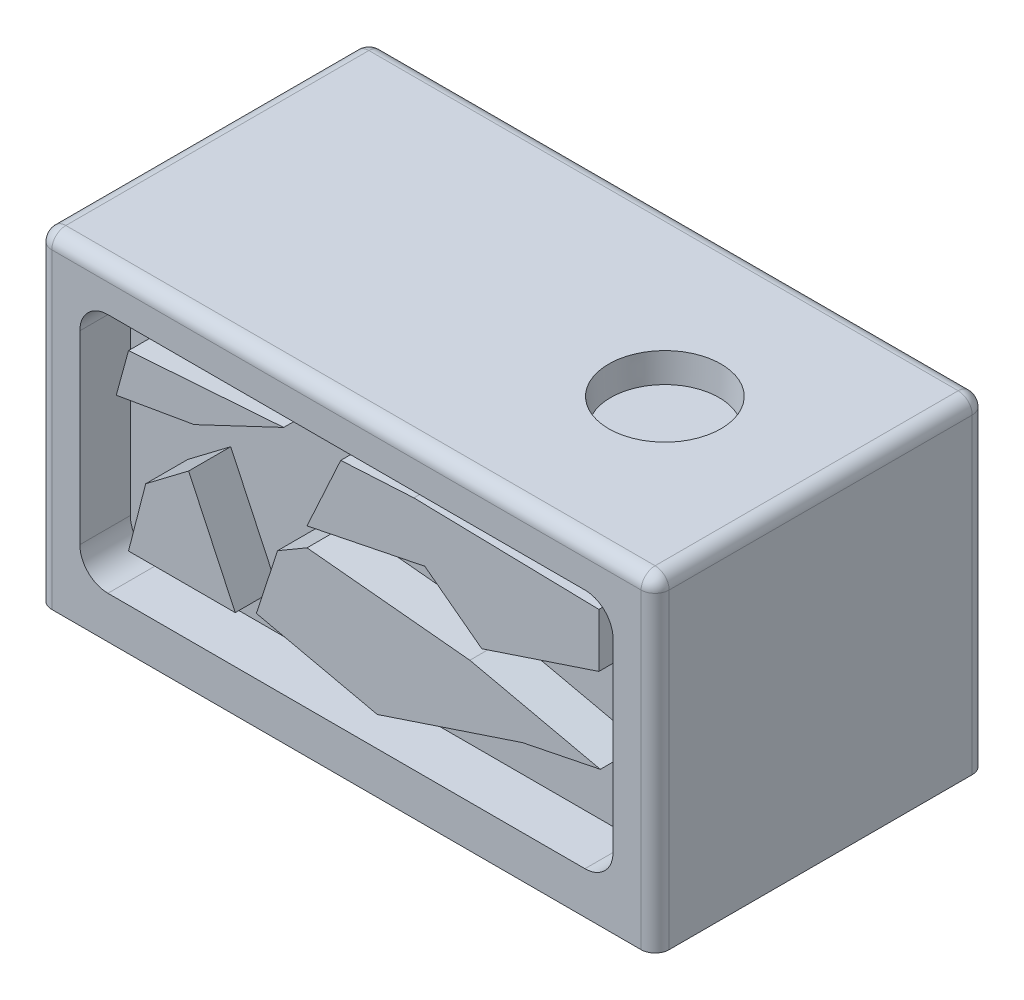
from build123d import *

# Parameters (mm, degrees)
SKETCH1_W           = 220
SKETCH1_H           = 100
SKETCH1_W_2         = 184
SKETCH1_H_2         = 64
BOSS_EXTRUDE1_DEPTH = 80
SKETCH11_W          = 220
SKETCH11_H          = 100
BOSS_EXTRUDE6_DEPTH = 18
SKETCH12_W          = 220
SKETCH12_H          = 100
BOSS_EXTRUDE7_DEPTH = 18
SKETCH2_W           = 220
SKETCH2_H           = 116
SKETCH2_W_2         = 190
SKETCH2_H_2         = 86
BOSS_EXTRUDE2_DEPTH = 18
BOSS_EXTRUDE3_DEPTH = 15
FILLET9_R           = 5
FILLET8_R           = 10
SKETCH13_R          = 5
BOSS_EXTRUDE8_DEPTH = 10
SKETCH14_W          = 16
SKETCH14_H          = 27
CUT_EXTRUDE1_DEPTH  = 10
CUT_EXTRUDE1_DRAFT  = -6
SKETCH15_R          = 20
CUT_EXTRUDE2_DEPTH  = 10
CUT_EXTRUDE2_DRAFT  = -4
SKETCH17_W          = 30
SKETCH17_H          = 40
CUT_EXTRUDE3_DEPTH  = 10


with BuildPart() as part:
    # Sketch1 → Boss-Extrude1 (new body)
    with BuildSketch(Plane(origin=(0, 0, 0), x_dir=(1, 0, 0), z_dir=(0, 1, 0))):
        with Locations((19.985024942, -17.460570406)):
            Rectangle(SKETCH1_W, SKETCH1_H)
        with Locations((19.985024942, -17.460570406)):
            Rectangle(SKETCH1_W_2, SKETCH1_H_2, mode=Mode.SUBTRACT)
    extrude(amount=BOSS_EXTRUDE1_DEPTH)

    # Sketch11 → Boss-Extrude6 (add)
    with BuildSketch(Plane(origin=(0, 80, 0), x_dir=(1, 0, 0), z_dir=(0, 1, 0))):
        with Locations((19.985024942, -17.460570406)):
            Rectangle(SKETCH11_W, SKETCH11_H)
    extrude(amount=BOSS_EXTRUDE6_DEPTH)

    # Sketch12 → Boss-Extrude7 (add)
    with BuildSketch(Plane.XZ):
        with Locations((19.985024942, 17.460570406)):
            Rectangle(SKETCH12_W, SKETCH12_H)
    extrude(amount=BOSS_EXTRUDE7_DEPTH)

    # Sketch2 → Boss-Extrude2 (add)
    with BuildSketch(Plane.XY.offset(67.460570406)):
        with Locations((19.985024942, 40)):
            Rectangle(SKETCH2_W, SKETCH2_H)
        with Locations((19.985024942, 40)):
            Rectangle(SKETCH2_W_2, SKETCH2_H_2, mode=Mode.SUBTRACT)
    extrude(amount=BOSS_EXTRUDE2_DEPTH)

    # Sketch3 → Boss-Extrude3 (add)
    with BuildSketch(Plane.XY.offset(67.460570406)):
        Polygon((14.957915815, 76.501183659), (2.936567903, 50.272788216), (44.902000614, 58.797016735), (65.229007083, 43.497119393), (98.451641312, 54.534902475), (106.944672327, 57.35660028), (106.944672327, 76.501183659), (41.011301547, 77.951227522), align=None)
        Polygon((-60.667291048, 72.566924343), (-65.038690289, 56.611317114), (-37.280305111, 61.419856279), (-5.369090654, 76.501183659), align=None)
        Polygon((-54.547332111, 34.535750949), (-39.247434769, 46.119958937), (-22.636117654, 10.711625088), (-60.667291048, 10.711625088), align=None)
        Polygon((-7.554790274, 37.377160456), (-15.111155502, 14.241854245), (27.984608681, 4.591666151), (79.685296007, 21.768539242), (107.463223985, 27.410930863), (60.959158385, 37.824320409), (2.936567903, 43.497119393), align=None)
    extrude(amount=BOSS_EXTRUDE3_DEPTH)

    # Fillet9
    fillet9_edges = [part.edges().sort_by_distance(p)[0] for p in [
        (-90.014975058, 98, 26.460570406),
        (129.985024942, 98, 26.460570406),
        (19.985024942, 98, -32.539429594),
        (19.985024942, 98, 85.460570406),
        (-90.014975058, 40, 85.460570406),
        (129.985024942, 40, 85.460570406),
        (-90.014975058, 40, -32.539429594),
        (129.985024942, 40, -32.539429594),
    ]]
    fillet(fillet9_edges, radius=FILLET9_R)

    # Fillet8
    fillet8_edges = [part.edges().sort_by_distance(p)[0] for p in [
        (-75.014975058, 83, 76.460570406),
        (114.985024942, 83, 76.460570406),
        (114.985024942, -3, 76.460570406),
        (-75.014975058, -3, 76.460570406),
    ]]
    fillet(fillet8_edges, radius=FILLET8_R)

    # Sketch13 → Boss-Extrude8 (add)
    with BuildSketch(Plane.XZ.offset(18)):
        with Locations(Location((-75.014975058, 70.460570406, 0), (0, 0, 270))):
            Circle(SKETCH13_R)
        with Locations(Location((114.985024942, 70.460570406, 0), (0, 0, 90))):
            Circle(SKETCH13_R)
        with Locations(Location((114.985024942, -17.539429594, 0), (0, 0, 270))):
            Circle(SKETCH13_R)
        with Locations(Location((-75.014975058, -17.539429594, 0), (0, 0, 90))):
            Circle(SKETCH13_R)
    extrude(amount=BOSS_EXTRUDE8_DEPTH)


with BuildPart() as cut_extrude1_tool:
    # Sketch14 → Cut-Extrude1 (with draft: the straight prism first)
    with BuildSketch(Plane.ZY.offset(90.014975058)):
        with Locations((26.460570406, 37.5)):
            Rectangle(SKETCH14_W, SKETCH14_H)
    extrude(amount=-CUT_EXTRUDE1_DEPTH)
    # Cut-Extrude1: the draft: its side faces are tilted about the plane it starts from
    cut_extrude1_sides = [cut_extrude1_tool.faces().sort_by_distance(p)[0] for p in [
        (-85.014975058, 37.5, 18.460570406),
        (-85.014975058, 24, 26.460570406),
        (-85.014975058, 37.5, 34.460570406),
        (-85.014975058, 51, 26.460570406),
    ]]
    draft(cut_extrude1_sides, Plane.ZY.offset(90.014975058), CUT_EXTRUDE1_DRAFT)


with BuildPart() as part_1:
    add(part.part)

    # Cut-Extrude1: cut by cut_extrude1_tool
    add(cut_extrude1_tool.part, mode=Mode.SUBTRACT)


with BuildPart() as cut_extrude2_tool:
    # Sketch15 → Cut-Extrude2 (with draft: the straight prism first)
    with BuildSketch(Plane(origin=(0, 98, 0), x_dir=(1, 0, 0), z_dir=(0, 1, 0))):
        with Locations((74.457875253, -26.460570406)):
            Circle(SKETCH15_R)
    extrude(amount=-CUT_EXTRUDE2_DEPTH)
    # Cut-Extrude2: the draft: its side faces are tilted about the plane it starts from
    cut_extrude2_sides = [cut_extrude2_tool.faces().sort_by_distance(p)[0] for p in [
        (54.457875253, 93, 26.460570406),
    ]]
    draft(cut_extrude2_sides, Plane(origin=(0, 98, 0), x_dir=(1, 0, 0), z_dir=(0, 1, 0)), CUT_EXTRUDE2_DRAFT)


with BuildPart() as part_2:
    add(part_1.part)

    # Cut-Extrude2: cut by cut_extrude2_tool
    add(cut_extrude2_tool.part, mode=Mode.SUBTRACT)

    # Sketch17 → Cut-Extrude3 (cut)
    with BuildSketch(Plane.XZ.offset(18)):
        with Locations((-45.014975058, 26.460570406)):
            Rectangle(SKETCH17_W, SKETCH17_H)
    extrude(amount=-CUT_EXTRUDE3_DEPTH, mode=Mode.SUBTRACT)


solid = part_2.part
